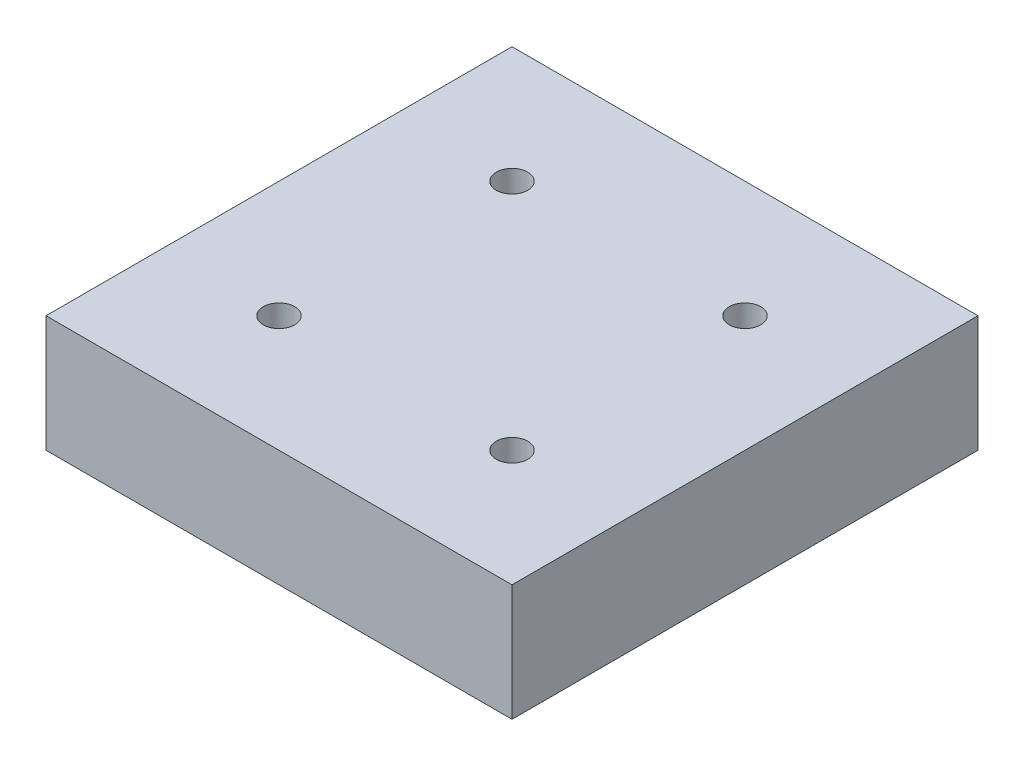
from build123d import *

# Parameters (mm, degrees)
CROQUIS1_W              = 40
CROQUIS1_H              = 40
CROQUIS1_R              = 1.35
SALIENTE_EXTRUIR1_DEPTH = 10
CROQUIS2_R              = 10
CROQUIS2_R_2            = 1.9
SALIENTE_EXTRUIR2_DEPTH = 8


with BuildPart() as part:
    # Croquis1 → Saliente-Extruir1 (new body)
    with BuildSketch(Plane(origin=(0, 0, 0), x_dir=(1, 0, 0), z_dir=(0, 1, 0))):
        Rectangle(CROQUIS1_W, CROQUIS1_H)
        with Locations(Location((-10, 10, 0), (0, 0, 270))):
            Circle(CROQUIS1_R, mode=Mode.SUBTRACT)
        with Locations(Location((10, 10, 0), (0, 0, 90))):
            Circle(CROQUIS1_R, mode=Mode.SUBTRACT)
        with Locations(Location((10, -10, 0), (0, 0, 270))):
            Circle(CROQUIS1_R, mode=Mode.SUBTRACT)
        with Locations(Location((-10, -10, 0), (0, 0, 90))):
            Circle(CROQUIS1_R, mode=Mode.SUBTRACT)
    extrude(amount=SALIENTE_EXTRUIR1_DEPTH)

    # Croquis2 → Saliente-Extruir2 (add)
    with BuildSketch(Plane(origin=(0, 0, -20), x_dir=(-1, 0, 0), z_dir=(0, 0, -1))):
        Circle(CROQUIS2_R)
        with Locations((0, -6)):
            Circle(CROQUIS2_R_2, mode=Mode.SUBTRACT)
    extrude(amount=-SALIENTE_EXTRUIR2_DEPTH)


solid = part.part
